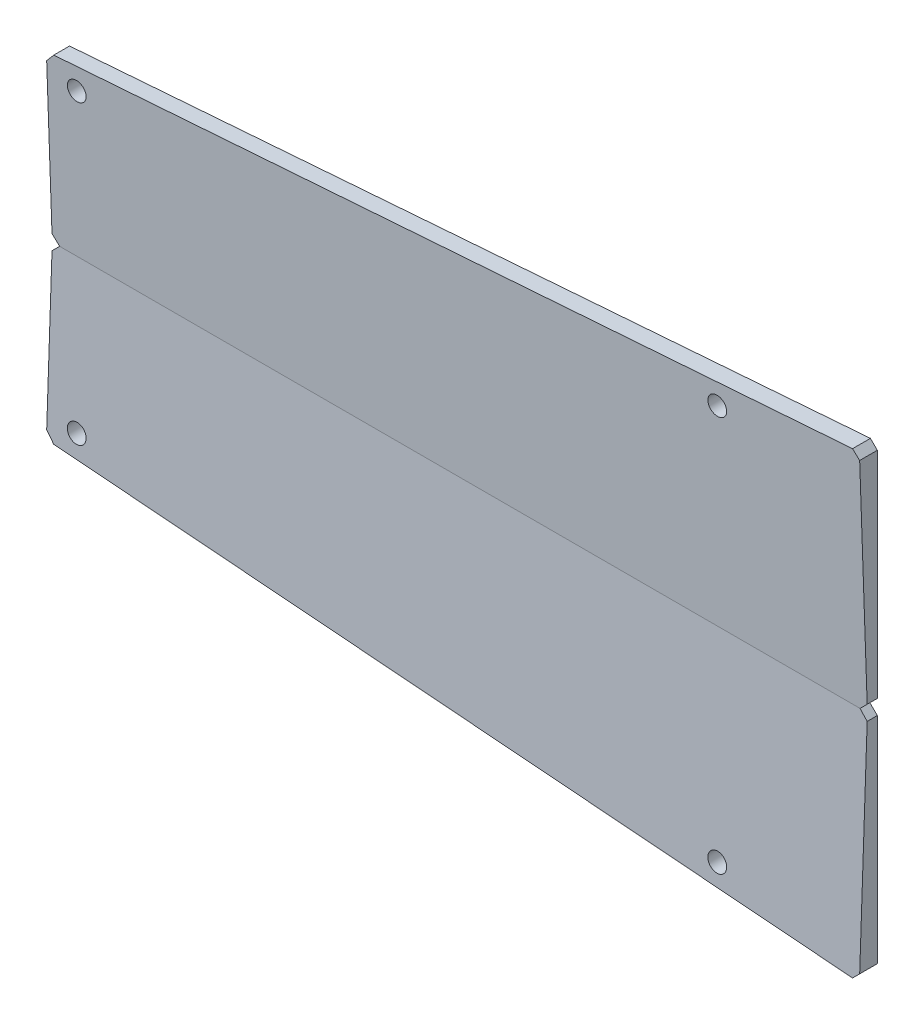
from build123d import *

# Parameters (mm, degrees)
ESQUISSE1_R      = 1.9
EXTRUSION1_DEPTH = 2
D_POUILLE1_ANGLE = 2
CHANFREIN1_SIZE  = 1.5
CHANFREIN1_SIZE2 = 1.398361753
CHANFREIN2_SIZE  = 1.5
CHANFREIN3_SIZE  = 1.5
CHANFREIN4_SIZE  = 1.5
CHANFREIN4_SIZE2 = 1.627601385


with BuildPart() as part:
    # Esquisse1 → Extrusion1 (new body)
    with BuildSketch(Plane.XY):
        Polygon((-49.438888889, 0), (115.561111111, 0), (115.561111111, 46.5), (-49.438888889, 34), align=None)
        with Locations((86.561111111, 40)):
            Circle(ESQUISSE1_R, mode=Mode.SUBTRACT)
        with Locations((-43.438888889, 30)):
            Circle(ESQUISSE1_R, mode=Mode.SUBTRACT)
    extrude(amount=EXTRUSION1_DEPTH)

    # Dépouille1
    d_pouille1_faces = [part.faces().sort_by_distance(p)[0] for p in [
        (37.385342989, 20.236326134, 2),
    ]]
    draft(d_pouille1_faces, Plane(origin=(-49.438888889, 0, 2), x_dir=(0, 0, -1), z_dir=(0, -1, 0)), D_POUILLE1_ANGLE)

    # Chanfrein1
    chanfrein1_edges = [part.edges().sort_by_distance(p)[0] for p in [
        (115.561111111, 46.5, 1.811907891),
    ]]
    chanfrein1_side = [part.faces().sort_by_distance(p)[0] for p in [
        (115.561111111, 25.487728403, 1.445025544),
    ]]
    chamfer(chanfrein1_edges, length=CHANFREIN1_SIZE, length2=CHANFREIN1_SIZE2, reference=chanfrein1_side[0])

    # Chanfrein2
    chanfrein2_edges = [part.edges().sort_by_distance(p)[0] for p in [
        (115.561111111, 0, 1),
    ]]
    chamfer(chanfrein2_edges, length=CHANFREIN2_SIZE)

    # Chanfrein3
    chanfrein3_edges = [part.edges().sort_by_distance(p)[0] for p in [
        (-49.438888889, 0, 1),
    ]]
    chamfer(chanfrein3_edges, length=CHANFREIN3_SIZE)

    # Chanfrein4
    chanfrein4_edges = [part.edges().sort_by_distance(p)[0] for p in [
        (-49.438888889, 34, 1.593653081),
    ]]
    chanfrein4_side = [part.faces().sort_by_distance(p)[0] for p in [
        (34.097619228, 40.328523342, 1.704151534),
    ]]
    chamfer(chanfrein4_edges, length=CHANFREIN4_SIZE, length2=CHANFREIN4_SIZE2, reference=chanfrein4_side[0])

    # Symétrie1: part across plane


with BuildPart() as part_1:
    add(part.part)
    add(part.part.mirror(Plane(origin=(-49.438888889, 0, 2), x_dir=(0, 0, 1), z_dir=(0, 1, 0))))


solid = part_1.part
